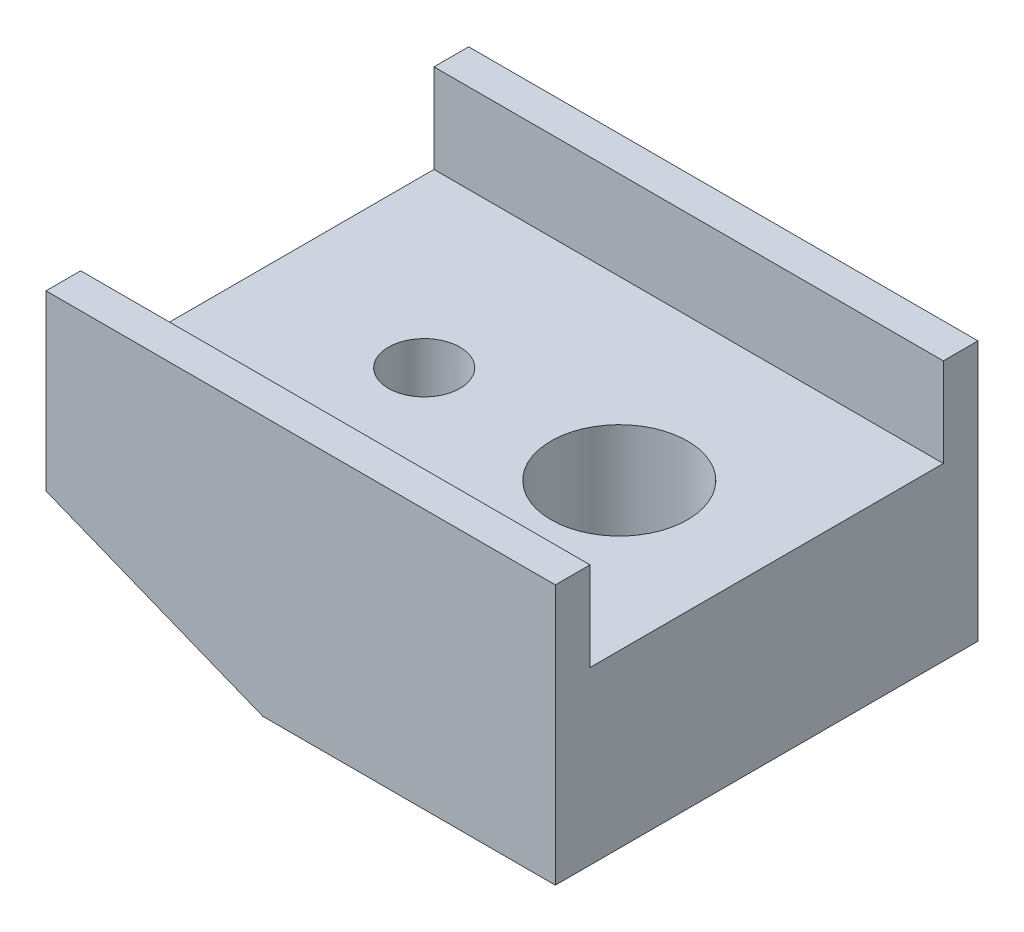
from build123d import *

# Parameters (mm, degrees)
EXTRUDE1_DEPTH            = 19.5
SKETCH2_W                 = 16.3
SKETCH2_H                 = 4.1
CUT_EXTRUDE1_DEPTH        = 33.810059433
M6_3_6_3_DIAMETER_HOLE1_D = 6.3
M4X0_7_TAPPED_HOLE1_D     = 3.3
M4X0_7_TAPPED_HOLE1_DEPTH = 10.1
M4X0_7_TAPPED_HOLE1_TIP   = 0.991420021


with BuildPart() as part:
    # Sketch1 → Extrude1 (new body)
    with BuildSketch(Plane.XY):
        Polygon((-13.5, 0), (-23.5, 4), (-23.5, 12), (0, 12), (0, 0), align=None)
    extrude(amount=EXTRUDE1_DEPTH)

    # Sketch2 → Cut-Extrude1 (cut, through all)
    with BuildSketch(Plane(origin=(0, 0, 0), x_dir=(0, 0, -1), z_dir=(1, 0, 0))):
        with Locations((-9.75, 9.95)):
            Rectangle(SKETCH2_W, SKETCH2_H)
    extrude(amount=-CUT_EXTRUDE1_DEPTH, mode=Mode.SUBTRACT)

    # M6.3 (6.3) Diameter Hole1 (through all)
    with Locations(Plane(origin=(-6.8, 7.9, 9.75), x_dir=(0, 0, 1), z_dir=(0, 1, 0))):
        with Locations((0, 0)):
            Hole(M6_3_6_3_DIAMETER_HOLE1_D / 2)

    # M4x0.7 Tapped Hole1
    with Locations(Plane(origin=(-15.8, 7.9, 9.75), x_dir=(0, 0, 1), z_dir=(0, 1, 0))):
        with Locations((0, 0)):
            Hole(M4X0_7_TAPPED_HOLE1_D / 2, depth=M4X0_7_TAPPED_HOLE1_DEPTH)
            with Locations((0, 0, -(M4X0_7_TAPPED_HOLE1_DEPTH + M4X0_7_TAPPED_HOLE1_TIP / 2))):  # 118° drill point
                Cone(0, M4X0_7_TAPPED_HOLE1_D / 2, M4X0_7_TAPPED_HOLE1_TIP, mode=Mode.SUBTRACT)


solid = part.part
